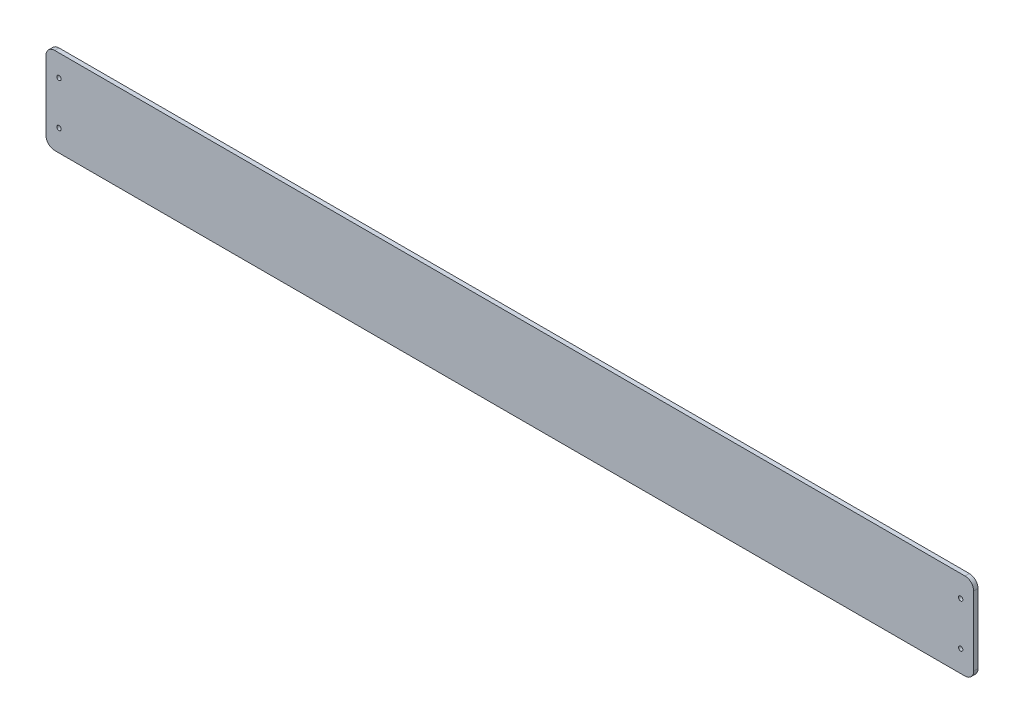
from build123d import *

# Parameters (mm, degrees)
CROQUIS1_W     = 1070
CROQUIS1_H     = 100
EXTRUIR1_DEPTH = 5
REDONDEO1_R    = 10
CROQUIS2_R     = 2.5
EXTRUIR2_DEPTH = 10


with BuildPart() as part:
    # Croquis1 → Extruir1 (new body)
    with BuildSketch(Plane.XY):
        Rectangle(CROQUIS1_W, CROQUIS1_H)
    extrude(amount=EXTRUIR1_DEPTH)

    # Redondeo1
    redondeo1_edges = [part.edges().sort_by_distance(p)[0] for p in [
        (-535, 50, 2.5),
        (535, 50, 2.5),
        (535, -50, 2.5),
        (-535, -50, 2.5),
    ]]
    fillet(redondeo1_edges, radius=REDONDEO1_R)

    # Croquis2 → Extruir2 (cut)
    with BuildSketch(Plane.XY.offset(5)):
        with Locations((-520, 25)):
            Circle(CROQUIS2_R)
        with Locations((-520, -25)):
            Circle(CROQUIS2_R)
        with Locations((520, -25)):
            Circle(CROQUIS2_R)
        with Locations((520, 25)):
            Circle(CROQUIS2_R)
    extrude(amount=-EXTRUIR2_DEPTH, mode=Mode.SUBTRACT)


solid = part.part
